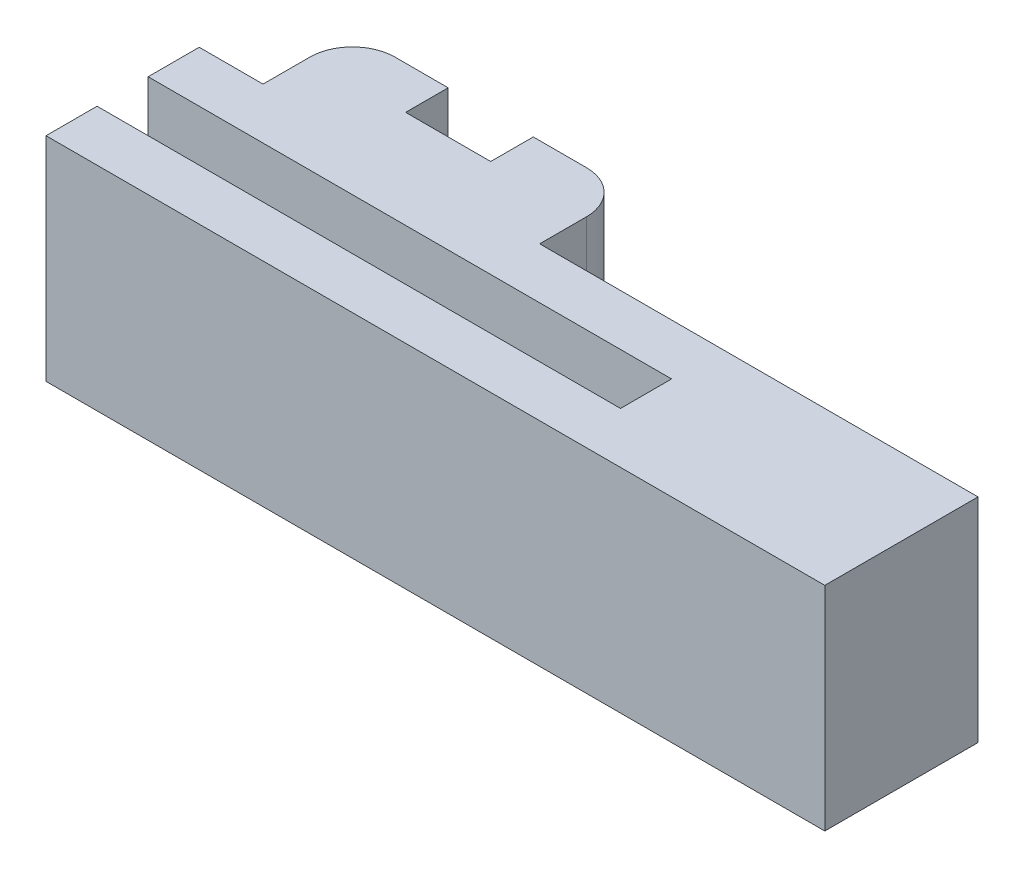
from build123d import *

# Parameters (mm, degrees)
BOSS_EXTRUDE1_DEPTH = 5
FILLET1_R           = 1


with BuildPart() as part:
    # Sketch1 → Boss-Extrude1 (new body)
    with BuildSketch(Plane(origin=(0, 0, 0), x_dir=(1, 0, 0), z_dir=(0, 1, 0))):
        Polygon((-8.753636364, 4.161818182), (-6.503636364, 4.161818182), (-6.503636364, 2.061818182), (3.796363636, 2.061818182), (3.796363636, -1.538181818), (-14.503636364, -1.538181818), (-14.503636364, -0.338181818), (-2.203636364, -0.338181818), (-2.203636364, 0.861818182), (-14.503636364, 0.861818182), (-14.503636364, 2.061818182), (-13.003636364, 2.061818182), (-13.003636364, 4.161818182), (-10.753636364, 4.161818182), (-10.753636364, 3.161818182), (-8.753636364, 3.161818182), align=None)
    extrude(amount=BOSS_EXTRUDE1_DEPTH)

    # Fillet1
    fillet1_edges = [part.edges().sort_by_distance(p)[0] for p in [
        (-13.003636364, 2.5, -4.161818182),
        (-6.503636364, 2.5, -4.161818182),
    ]]
    fillet(fillet1_edges, radius=FILLET1_R)


solid = part.part
